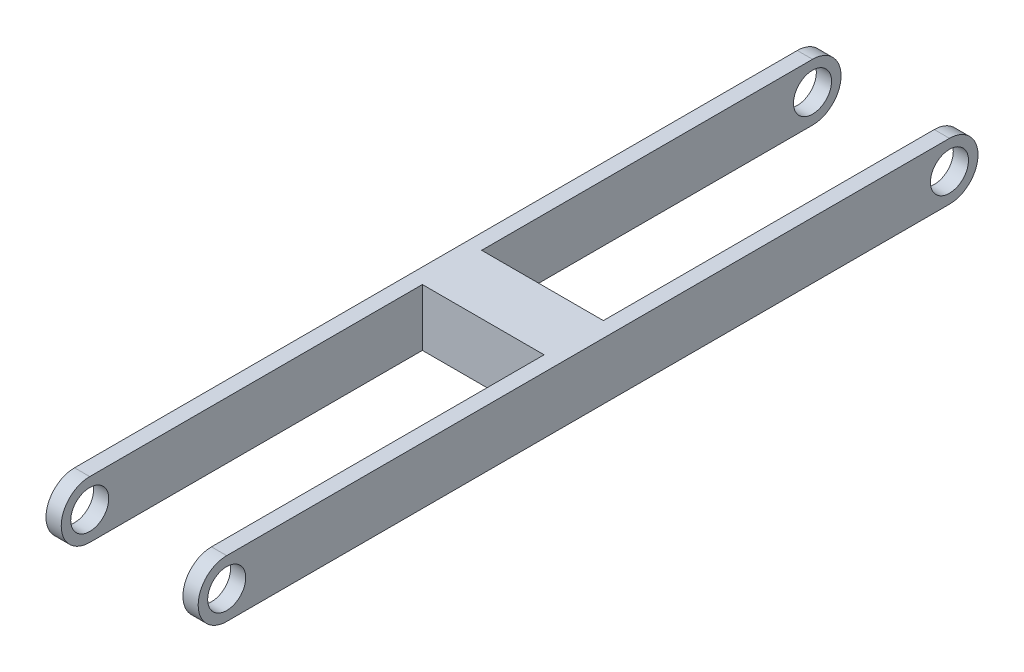
from build123d import *

# Parameters (mm, degrees)
SKETCH1_R               = 2.5
BOSS_EXTRUDE1_DEPTH     = 20
CUT_EXTRUDE1_DEPTH      = 56.523080786
CUT_EXTRUDE1_DEPTH_BACK = 56.523080786
SKETCH2_W               = 16
SKETCH2_H               = 47.239813723
SKETCH2_H_2             = 47.470835296


with BuildPart() as part:
    # Sketch1 → Boss-Extrude1 (new body)
    with BuildSketch(Plane(origin=(0, 0, 0), x_dir=(0, 0, -1), z_dir=(1, 0, 0))):
        with BuildLine():
            Line((47.5, 3.75), (-47.5, 3.75))
            ThreePointArc((-47.5, 3.75), (-51.25, 0), (-47.5, -3.75))
            Line((-47.5, -3.75), (47.5, -3.75))
            ThreePointArc((47.5, -3.75), (51.25, 0), (47.5, 3.75))
        make_face()
        with Locations((-47.5, 0)):
            Circle(SKETCH1_R, mode=Mode.SUBTRACT)
        with Locations((47.5, 0)):
            Circle(SKETCH1_R, mode=Mode.SUBTRACT)
    extrude(amount=BOSS_EXTRUDE1_DEPTH)

    # Sketch2 → Cut-Extrude1 (cut, two sides: drawn at the far end of the back side and taken through both)
    with BuildSketch(Plane(origin=(0, 3.75, 0), x_dir=(1, 0, 0), z_dir=(0, 1, 0)).offset(-CUT_EXTRUDE1_DEPTH_BACK)):
        with Locations((10, 27.630093139)):
            Rectangle(SKETCH2_W, SKETCH2_H)
        with Locations((10, -27.514582352)):
            Rectangle(SKETCH2_W, SKETCH2_H_2)
    extrude(amount=CUT_EXTRUDE1_DEPTH + CUT_EXTRUDE1_DEPTH_BACK, mode=Mode.SUBTRACT)


solid = part.part
